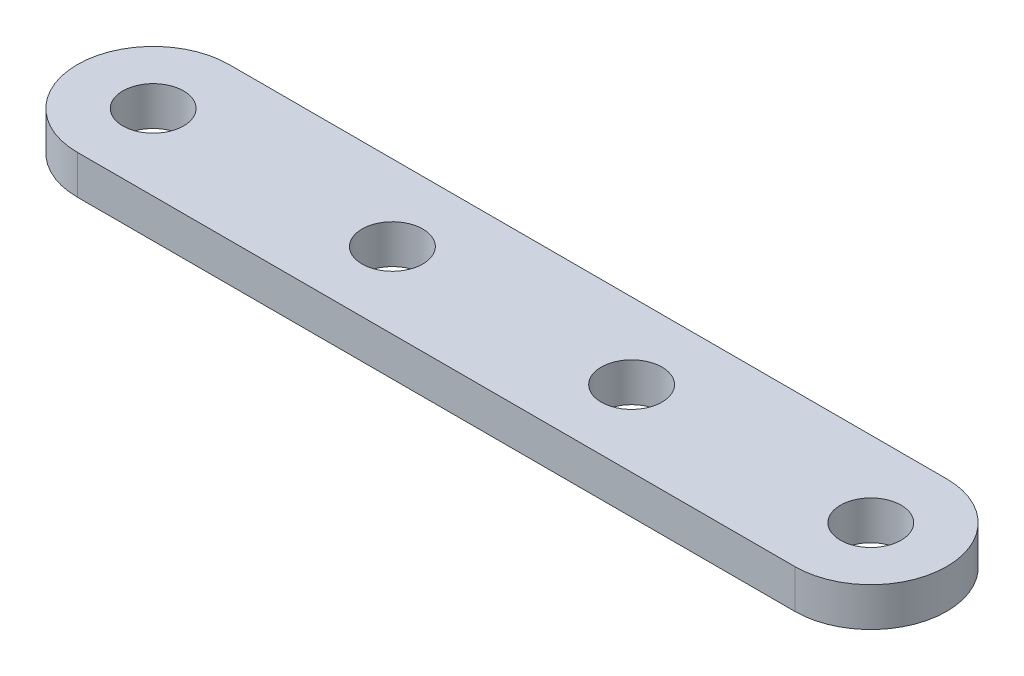
from build123d import *

# Parameters (mm, degrees)
SKETCH1_R           = 2.54
BOSS_EXTRUDE1_DEPTH = 3.25


with BuildPart() as part:
    # Sketch1 → Boss-Extrude1 (new body)
    with BuildSketch(Plane(origin=(0, 0, 0), x_dir=(1, 0, 0), z_dir=(0, 1, 0))):
        with BuildLine():
            Line((0, 6.35), (60, 6.35))
            ThreePointArc((60, 6.35), (66.35, 0), (60, -6.35))
            Line((60, -6.35), (0, -6.35))
            ThreePointArc((0, -6.35), (-6.35, 0), (0, 6.35))
        make_face()
        with Locations(Location((0, 0, 0), (0, 0, 90))):
            Circle(SKETCH1_R, mode=Mode.SUBTRACT)
        with Locations(Location((20, 0, 0), (0, 0, 90))):
            Circle(SKETCH1_R, mode=Mode.SUBTRACT)
        with Locations(Location((40, 0, 0), (0, 0, 90))):
            Circle(SKETCH1_R, mode=Mode.SUBTRACT)
        with Locations(Location((60, 0, 0), (0, 0, 90))):
            Circle(SKETCH1_R, mode=Mode.SUBTRACT)
    extrude(amount=BOSS_EXTRUDE1_DEPTH)


solid = part.part
